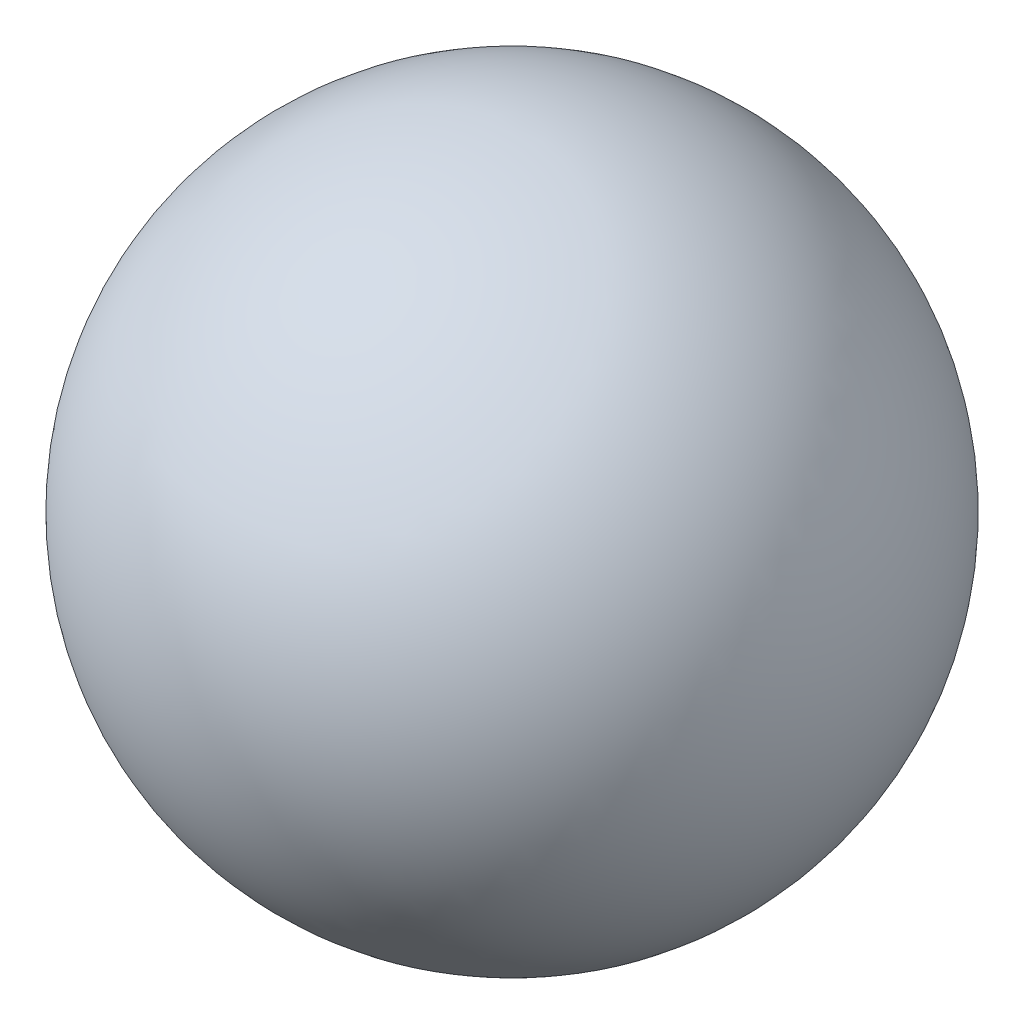
from build123d import *


with BuildPart() as part:
    # Sketch1 → Revolve5 (revolve)
    with BuildSketch(Plane.XY):
        with BuildLine():
            Line((0, 4.7625), (0, -4.7625))
            ThreePointArc((0, -4.7625), (4.7625, 0), (0, 4.7625))
        make_face()
    revolve(axis=Axis((0, 4.7625, 0), (0, -1, 0)))


solid = part.part
